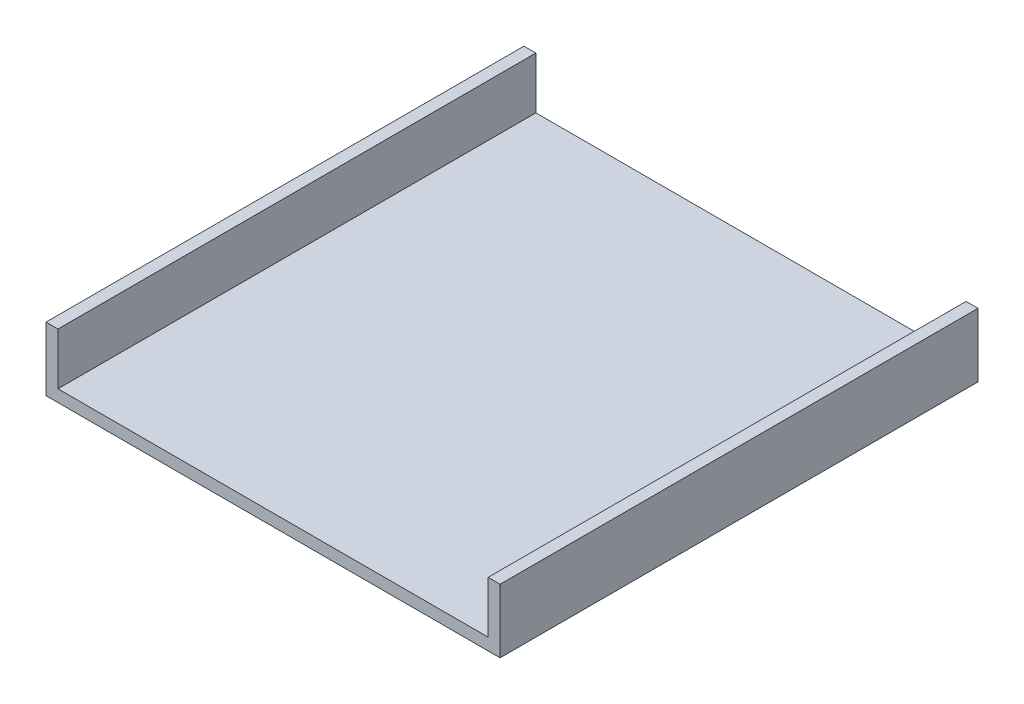
from build123d import *

# Parameters (mm, degrees)
BOSS_EXTRUDE1_DEPTH      = 60
BOSS_EXTRUDE1_DEPTH_BACK = 60
SKETCH1_W                = 114
SKETCH1_H                = 16
SKETCH2_W                = 108
SKETCH2_H                = 26
CUT_EXTRUDE1_DEPTH       = 134.090194981


with BuildPart() as part:
    # Sketch1 → Boss-Extrude1 (new, two sides: drawn at the far end of the back side and taken through both)
    with BuildSketch(Plane.XY.offset(-BOSS_EXTRUDE1_DEPTH_BACK)):
        Rectangle(SKETCH1_W, SKETCH1_H)
    extrude(amount=BOSS_EXTRUDE1_DEPTH + BOSS_EXTRUDE1_DEPTH_BACK)

    # Sketch2 → Cut-Extrude1 (cut, through all)
    with BuildSketch(Plane.XY.offset(60)):
        with Locations((0, 8)):
            Rectangle(SKETCH2_W, SKETCH2_H)
    extrude(amount=-CUT_EXTRUDE1_DEPTH, mode=Mode.SUBTRACT)


solid = part.part
